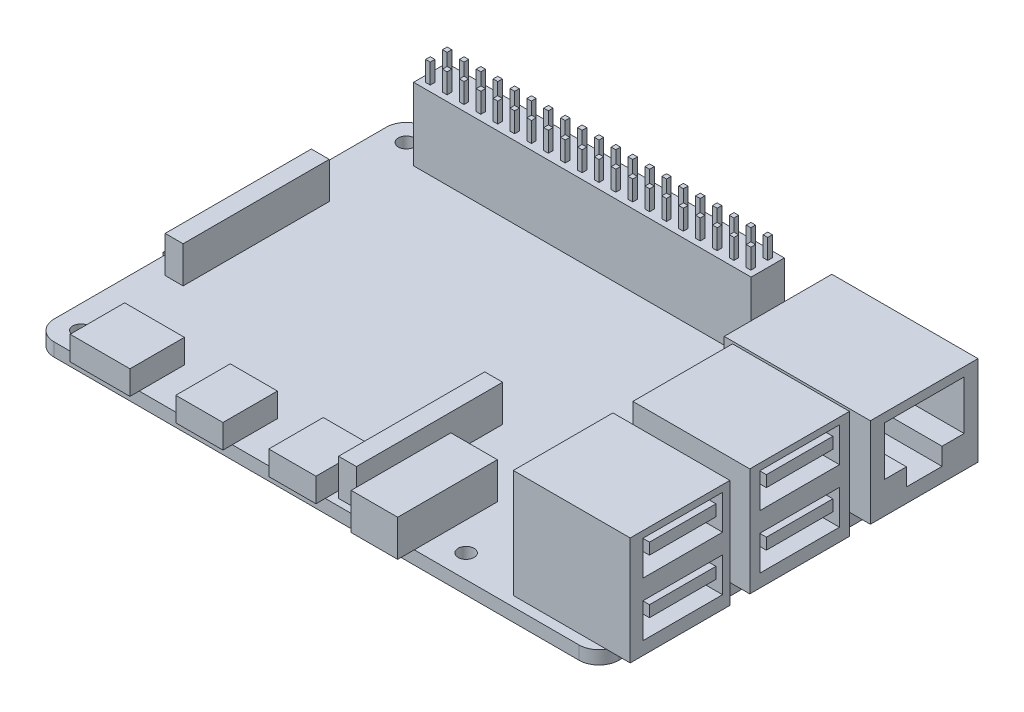
from build123d import *

# Parameters (mm, degrees)
ESQUISSE1_W             = 85
ESQUISSE1_H             = 56
BOSS_EXTRU_1_DEPTH      = 2
D_GAGEMENT_M21_D        = 2.4
ESQUISSE4_W             = 50.8
ESQUISSE4_H             = 5
BOSS_EXTRU_3_DEPTH      = 10.9
ESQUISSE6_W             = 0.7
ESQUISSE6_H             = 0.7
BOSS_EXTRU_5_DEPTH      = 3
ESQUISSE3_W             = 14.4
ESQUISSE3_H             = 15
ESQUISSE3_W_2           = 3.2
BOSS_EXTRU_2_DEPTH      = 16.3
ESQUISSE3_3_W           = 18.8
ESQUISSE3_3_H           = 16.2
ESQUISSE3_3_W_2         = 3.2
BOSS_EXTRU_8_DEPTH      = 13.5
ESQUISSE7_W             = 12
ESQUISSE7_H             = 5.2
ESQUISSE7_W_2           = 10
ESQUISSE7_H_2           = 1.7
ENL_V_MAT_EXTRU_1_DEPTH = 12
ESQUISSE5_W             = 9
ESQUISSE5_H             = 8.2
ESQUISSE5_W_2           = 7.1
BOSS_EXTRU_4_DEPTH      = 3.6
ESQUISSE8_W             = 7
ESQUISSE8_H             = 15
ESQUISSE8_W_2           = 2.7
ESQUISSE8_H_2           = 22
BOSS_EXTRU_6_DEPTH      = 5.5
ESQUISSE9_W             = 15.5
ESQUISSE9_H             = 12.2
BOSS_EXTRU_7_DEPTH      = 1.5
CONG_1_R                = 3


with BuildPart() as part:
    # Esquisse1 → Boss.-Extru.1 (new body)
    with BuildSketch(Plane(origin=(0, 0, 0), x_dir=(1, 0, 0), z_dir=(0, 1, 0))):
        Rectangle(ESQUISSE1_W, ESQUISSE1_H)
    extrude(amount=BOSS_EXTRU_1_DEPTH)

    # Dégagement M21 (through all)
    with Locations(Plane(origin=(-39, 2, -24.5), x_dir=(0, 0, 1), z_dir=(0, 1, 0))):
        with Locations((0, 0), (49, 0), (0, 58), (49, 58)):
            Hole(D_GAGEMENT_M21_D / 2)

    # Esquisse4 → Boss.-Extru.3 (add)
    with BuildSketch(Plane(origin=(0, 2, 0), x_dir=(1, 0, 0), z_dir=(0, 1, 0))):
        with Locations((-10, 24.5)):
            Rectangle(ESQUISSE4_W, ESQUISSE4_H)
    extrude(amount=BOSS_EXTRU_3_DEPTH)

    # Esquisse6 → Boss.-Extru.5 (add)
    with BuildSketch(Plane(origin=(0, 12.9, 0), x_dir=(1, 0, 0), z_dir=(0, 1, 0))):
        with Locations((-11.27, 25.77)):
            Rectangle(ESQUISSE6_W, ESQUISSE6_H)
        with Locations((-8.73, 25.77)):
            Rectangle(ESQUISSE6_W, ESQUISSE6_H)
        with Locations((-8.73, 23.23)):
            Rectangle(ESQUISSE6_W, ESQUISSE6_H)
        with Locations((-11.27, 23.23)):
            Rectangle(ESQUISSE6_W, ESQUISSE6_H)
        with Locations((-13.81, 25.77)):
            Rectangle(ESQUISSE6_W, ESQUISSE6_H)
        with Locations((-16.35, 25.77)):
            Rectangle(ESQUISSE6_W, ESQUISSE6_H)
        with Locations((-18.89, 25.77)):
            Rectangle(ESQUISSE6_W, ESQUISSE6_H)
        with Locations((-21.43, 25.77)):
            Rectangle(ESQUISSE6_W, ESQUISSE6_H)
        with Locations((-23.97, 25.77)):
            Rectangle(ESQUISSE6_W, ESQUISSE6_H)
        with Locations((-26.51, 25.77)):
            Rectangle(ESQUISSE6_W, ESQUISSE6_H)
        with Locations((-29.05, 25.77)):
            Rectangle(ESQUISSE6_W, ESQUISSE6_H)
        with Locations((-31.59, 25.77)):
            Rectangle(ESQUISSE6_W, ESQUISSE6_H)
        with Locations((-34.13, 25.77)):
            Rectangle(ESQUISSE6_W, ESQUISSE6_H)
        with Locations((-34.13, 23.23)):
            Rectangle(ESQUISSE6_W, ESQUISSE6_H)
        with Locations((-31.59, 23.23)):
            Rectangle(ESQUISSE6_W, ESQUISSE6_H)
        with Locations((-29.05, 23.23)):
            Rectangle(ESQUISSE6_W, ESQUISSE6_H)
        with Locations((-26.51, 23.23)):
            Rectangle(ESQUISSE6_W, ESQUISSE6_H)
        with Locations((-23.97, 23.23)):
            Rectangle(ESQUISSE6_W, ESQUISSE6_H)
        with Locations((-21.43, 23.23)):
            Rectangle(ESQUISSE6_W, ESQUISSE6_H)
        with Locations((-18.89, 23.23)):
            Rectangle(ESQUISSE6_W, ESQUISSE6_H)
        with Locations((-16.35, 23.23)):
            Rectangle(ESQUISSE6_W, ESQUISSE6_H)
        with Locations((-13.81, 23.23)):
            Rectangle(ESQUISSE6_W, ESQUISSE6_H)
        with Locations((14.13, 25.77)):
            Rectangle(ESQUISSE6_W, ESQUISSE6_H)
        with Locations((11.59, 25.77)):
            Rectangle(ESQUISSE6_W, ESQUISSE6_H)
        with Locations((9.05, 25.77)):
            Rectangle(ESQUISSE6_W, ESQUISSE6_H)
        with Locations((6.51, 25.77)):
            Rectangle(ESQUISSE6_W, ESQUISSE6_H)
        with Locations((3.97, 25.77)):
            Rectangle(ESQUISSE6_W, ESQUISSE6_H)
        with Locations((1.43, 25.77)):
            Rectangle(ESQUISSE6_W, ESQUISSE6_H)
        with Locations((-1.11, 25.77)):
            Rectangle(ESQUISSE6_W, ESQUISSE6_H)
        with Locations((-3.65, 25.77)):
            Rectangle(ESQUISSE6_W, ESQUISSE6_H)
        with Locations((-6.19, 25.77)):
            Rectangle(ESQUISSE6_W, ESQUISSE6_H)
        with Locations((-6.19, 23.23)):
            Rectangle(ESQUISSE6_W, ESQUISSE6_H)
        with Locations((-3.65, 23.23)):
            Rectangle(ESQUISSE6_W, ESQUISSE6_H)
        with Locations((-1.11, 23.23)):
            Rectangle(ESQUISSE6_W, ESQUISSE6_H)
        with Locations((1.43, 23.23)):
            Rectangle(ESQUISSE6_W, ESQUISSE6_H)
        with Locations((3.97, 23.23)):
            Rectangle(ESQUISSE6_W, ESQUISSE6_H)
        with Locations((6.51, 23.23)):
            Rectangle(ESQUISSE6_W, ESQUISSE6_H)
        with Locations((9.05, 23.23)):
            Rectangle(ESQUISSE6_W, ESQUISSE6_H)
        with Locations((11.59, 23.23)):
            Rectangle(ESQUISSE6_W, ESQUISSE6_H)
        with Locations((14.13, 23.23)):
            Rectangle(ESQUISSE6_W, ESQUISSE6_H)
    extrude(amount=BOSS_EXTRU_5_DEPTH)

    # Esquisse5 → Boss.-Extru.4 (add)
    with BuildSketch(Plane(origin=(0, 2, 0), x_dir=(1, 0, 0), z_dir=(0, 1, 0))):
        with Locations((-31.2, -25.3)):
            Rectangle(ESQUISSE5_W, ESQUISSE5_H)
        with Locations((-16.25, -25.3)):
            Rectangle(ESQUISSE5_W_2, ESQUISSE5_H)
        with Locations((-2.25, -25.3)):
            Rectangle(ESQUISSE5_W_2, ESQUISSE5_H)
    extrude(amount=BOSS_EXTRU_4_DEPTH)

    # Esquisse8 → Boss.-Extru.6 (add)
    with BuildSketch(Plane(origin=(0, 2, 0), x_dir=(1, 0, 0), z_dir=(0, 1, 0))):
        with Locations((11.2, -23)):
            Rectangle(ESQUISSE8_W, ESQUISSE8_H)
        with Locations((3.65, -16)):
            Rectangle(ESQUISSE8_W_2, ESQUISSE8_H_2)
        with Locations((-38.45, 0)):
            Rectangle(ESQUISSE8_W_2, ESQUISSE8_H_2)
    extrude(amount=BOSS_EXTRU_6_DEPTH)

    # Esquisse9 → Boss.-Extru.7 (add)
    with BuildSketch(Plane.XZ):
        with Locations((-37.25, 0)):
            Rectangle(ESQUISSE9_W, ESQUISSE9_H)
    extrude(amount=BOSS_EXTRU_7_DEPTH)

    # Congé1
    cong_1_edges = [part.edges().sort_by_distance(p)[0] for p in [
        (42.5, 1, 28),
        (-42.5, 1, 28),
        (-42.5, 1, -28),
        (42.5, 1, -28),
    ]]
    fillet(cong_1_edges, radius=CONG_1_R)


with BuildPart() as body_2:
    # Esquisse3 → Boss.-Extru.2 (new body)
    with BuildSketch(Plane(origin=(0, 2, 0), x_dir=(1, 0, 0), z_dir=(0, 1, 0))):
        with Locations((35.3, -1)):
            Rectangle(ESQUISSE3_W, ESQUISSE3_H)
        with Locations((35.3, -19)):
            Rectangle(ESQUISSE3_W, ESQUISSE3_H)
        with Locations((44.1, -19)):
            Rectangle(ESQUISSE3_W_2, ESQUISSE3_H)
        with Locations((44.1, -1)):
            Rectangle(ESQUISSE3_W_2, ESQUISSE3_H)
    extrude(amount=BOSS_EXTRU_2_DEPTH)


with BuildPart() as body_3:
    # Esquisse3<3> → Boss.-Extru.8 (new body)
    with BuildSketch(Plane(origin=(0, 2, 0), x_dir=(1, 0, 0), z_dir=(0, 1, 0))):
        with Locations((33.1, 17.75)):
            Rectangle(ESQUISSE3_3_W, ESQUISSE3_3_H)
        with Locations((44.1, 17.75)):
            Rectangle(ESQUISSE3_3_W_2, ESQUISSE3_3_H)
    extrude(amount=BOSS_EXTRU_8_DEPTH)


with BuildPart() as enl_v_mat_extru_1_tool:
    # Esquisse7 → Enlèv. mat.-Extru.1 (new body)
    # profile 1 of 5: a face of its own
    with BuildSketch(Plane(origin=(45.7, 0, 0), x_dir=(0, 0, -1), z_dir=(1, 0, 0))):
        Polygon((23.75943425, 14.159838541), (11.75943425, 14.159838541), (11.75943425, 6.785251797), (15.080363944, 6.785251797), (15.080363944, 4.159838541), (20.438504557, 4.159838541), (20.438504557, 6.785251797), (23.75943425, 6.785251797), align=None)
    # profile 2 of 5: a face of its own
    with BuildSketch(Plane(origin=(45.7, 0, 0), x_dir=(0, 0, -1), z_dir=(1, 0, 0))):
        with Locations((-18.6, 14.7)):
            Rectangle(ESQUISSE7_W, ESQUISSE7_H)
        with Locations((-18.6, 15.45)):
            Rectangle(ESQUISSE7_W_2, ESQUISSE7_H_2, mode=Mode.SUBTRACT)
    # profile 3 of 5: a face of its own
    with BuildSketch(Plane(origin=(45.7, 0, 0), x_dir=(0, 0, -1), z_dir=(1, 0, 0))):
        with Locations((-1, 14.7)):
            Rectangle(ESQUISSE7_W, ESQUISSE7_H)
        with Locations((-1, 15.45)):
            Rectangle(ESQUISSE7_W_2, ESQUISSE7_H_2, mode=Mode.SUBTRACT)
    # profile 4 of 5: a face of its own
    with BuildSketch(Plane(origin=(45.7, 0, 0), x_dir=(0, 0, -1), z_dir=(1, 0, 0))):
        with Locations((-18.6, 6.55)):
            Rectangle(ESQUISSE7_W, ESQUISSE7_H)
        with Locations((-18.6, 7.3)):
            Rectangle(ESQUISSE7_W_2, ESQUISSE7_H_2, mode=Mode.SUBTRACT)
    # profile 5 of 5: a face of its own
    with BuildSketch(Plane(origin=(45.7, 0, 0), x_dir=(0, 0, -1), z_dir=(1, 0, 0))):
        with Locations((-1, 6.55)):
            Rectangle(ESQUISSE7_W, ESQUISSE7_H)
        with Locations((-1, 7.3)):
            Rectangle(ESQUISSE7_W_2, ESQUISSE7_H_2, mode=Mode.SUBTRACT)
    extrude(amount=-ENL_V_MAT_EXTRU_1_DEPTH)


with BuildPart() as body_2_1:
    add(body_2.part)

    # Enlèv. mat.-Extru.1: cut by enl_v_mat_extru_1_tool
    add(enl_v_mat_extru_1_tool.part, mode=Mode.SUBTRACT)


with BuildPart() as body_3_1:
    add(body_3.part)

    # Enlèv. mat.-Extru.1: cut by enl_v_mat_extru_1_tool
    add(enl_v_mat_extru_1_tool.part, mode=Mode.SUBTRACT)


solid = Compound([part.part, body_2_1.part, body_3_1.part])
